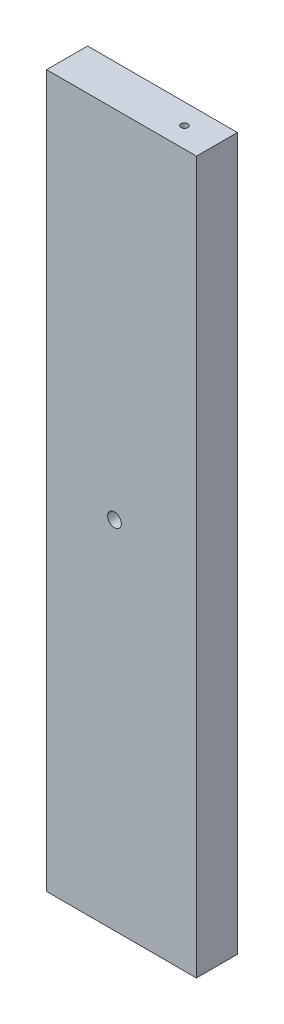
from build123d import *

# Parameters (mm, degrees)
SKETCH1_W                   = 69.666978681
SKETCH1_H                   = 330.949999988
BOSS_EXTRUDE1_DEPTH         = 19.05
F_1_4_0_25_DIAMETER_HOLE1_D = 6.35
HOLE5_D                     = 3.175
HOLE5_DEPTH                 = 38.1
HOLE5_CSINK_D               = 10.16
HOLE5_CSINK_ANGLE           = 82
HOLE5_TIP                   = 0.953866233


with BuildPart() as part:
    # Sketch1 → Boss-Extrude1 (new body)
    with BuildSketch(Plane.XY):
        with Locations((244.186456522, -72.024999997)):
            Rectangle(SKETCH1_W, SKETCH1_H)
    extrude(amount=BOSS_EXTRUDE1_DEPTH)

    # 1/4 (0.25) Diameter Hole1 (through all)
    with Locations(Plane(origin=(0, 0, 0), x_dir=(-1, 0, 0), z_dir=(0, 0, -1))):
        with Locations((-240.919945862, -72.024999997)):
            Hole(F_1_4_0_25_DIAMETER_HOLE1_D / 2)

    # Hole5
    with Locations(Plane(origin=(-181.039434513, 112.499999997, 580.972905015), x_dir=(0.9271838545667913, -6.190403823971236e-15, -0.3746065934159023), z_dir=(0, 1, 0))):
        with Locations((77.689167439, 113.488854888), (70.865650555, 37.945520226), (443.755923515, 80.423559293), (438.7765707, 25.297013484), (549.651376608, 172.604565212), (567.144534626, 165.5368706), (580.227669901, 197.918766721), (644.129452085, 356.081227714), (562.734511883, 204.986461333), (626.636294067, 363.148922326)):
            CounterSinkHole(HOLE5_D / 2, HOLE5_CSINK_D / 2, depth=HOLE5_DEPTH, counter_sink_angle=HOLE5_CSINK_ANGLE)
            with Locations((0, 0, -(HOLE5_DEPTH + HOLE5_TIP / 2))):  # 118° drill point
                Cone(0, HOLE5_D / 2, HOLE5_TIP, mode=Mode.SUBTRACT)


solid = part.part
